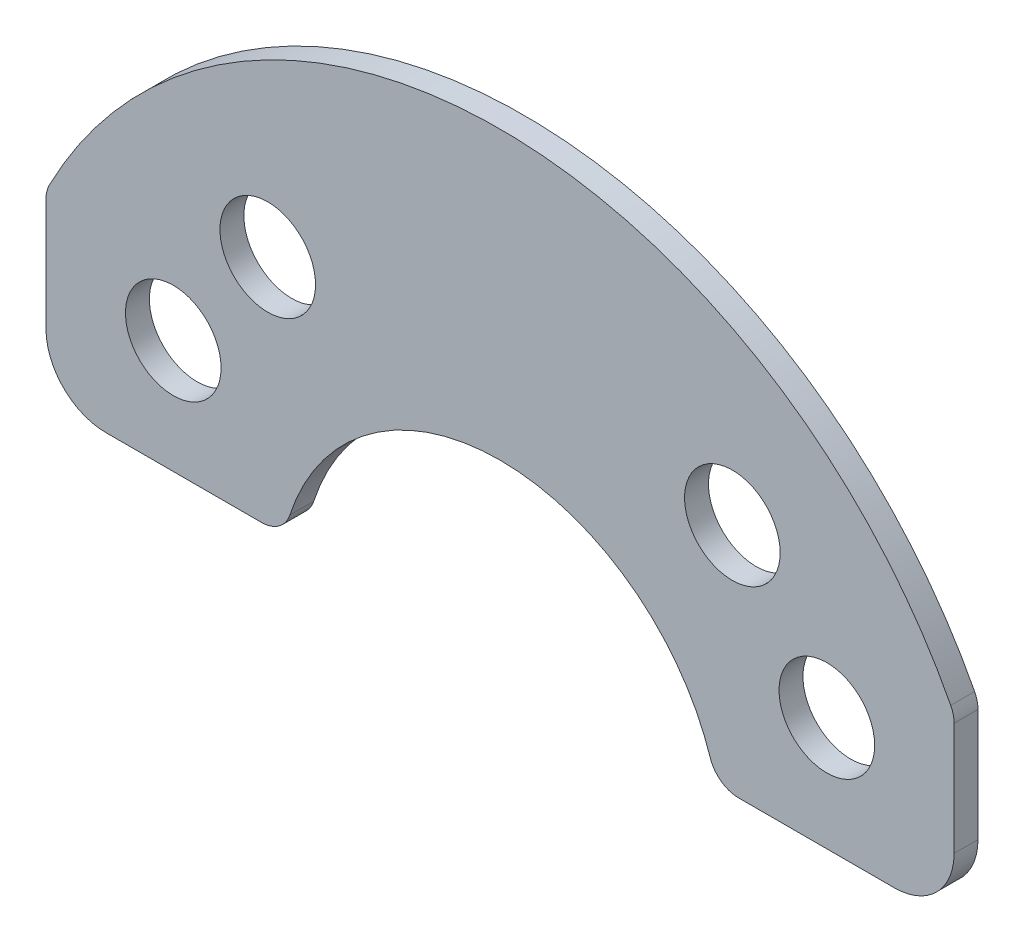
from build123d import *

# Parameters (mm, degrees)
BOSS_EXTRUDE1_DEPTH = 1
SKETCH2_R           = 4
CUT_EXTRUDE1_DEPTH  = 58.046034043
FILLET1_R           = 5
FILLET2_R           = 2.5


with BuildPart() as part:
    # Sketch1 → Boss-Extrude1 (new, symmetric)
    with BuildSketch(Plane.XY):
        with BuildLine():
            Line((-38, 4), (-18.062391868, 4))
            ThreePointArc((-18.062391868, 4), (0, 18.5), (18.062391868, 4))
            Line((18.062391868, 4), (38, 4))
            Line((38, 4), (38, 19.032866311))
            ThreePointArc((38, 19.032866311), (0, 42.5), (-38, 19.032866311))
            Line((-38, 19.032866311), (-38, 4))
        make_face()
    extrude(amount=BOSS_EXTRUDE1_DEPTH, both=True)

    # Sketch2 → Cut-Extrude1 (cut, through all)
    with BuildSketch(Plane.XY.offset(1)):
        with Locations((-27.349588662, 13.5)):
            Circle(SKETCH2_R)
        with Locations((-19.442222095, 23.5)):
            Circle(SKETCH2_R)
        with Locations((19.442222095, 23.5)):
            Circle(SKETCH2_R)
        with Locations((27.349588662, 13.5)):
            Circle(SKETCH2_R)
    extrude(amount=-CUT_EXTRUDE1_DEPTH, mode=Mode.SUBTRACT)

    # Fillet1
    fillet1_edges = [part.edges().sort_by_distance(p)[0] for p in [
        (38, 4, 0),
        (-38, 4, 0),
    ]]
    fillet(fillet1_edges, radius=FILLET1_R)

    # Fillet2
    fillet2_edges = [part.edges().sort_by_distance(p)[0] for p in [
        (-38, 19.032866311, 0),
        (38, 19.032866311, 0),
        (18.062391868, 4, 0),
        (-18.062391868, 4, 0),
    ]]
    fillet(fillet2_edges, radius=FILLET2_R)


solid = part.part
